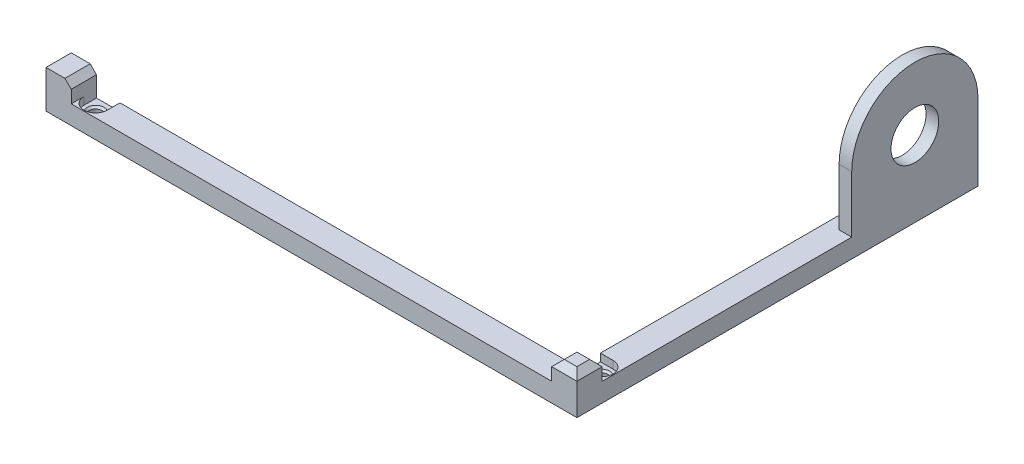
from build123d import *

# Parameters (mm, degrees)
BOSS_EXTRUDE1_DEPTH                    = 6.35
SKETCH3_W                              = 8.466666667
SKETCH3_H                              = 8.466666667
SKETCH3_W_2                            = 8.466666666
BOSS_EXTRUDE2_DEPTH                    = 6.349999915
SKETCH8_W                              = 8.466666666
SKETCH8_H                              = 8.466666666
BOSS_EXTRUDE4_DEPTH                    = 19.049999915
CUT_EXTRUDE1_DEPTH                     = 5.08
CUT_EXTRUDE2_DEPTH                     = 5.08
CUT_EXTRUDE3_DEPTH                     = 5.08
CHAMFER1_SIZE                          = 0.635
SKETCH7_R                              = 8
BOSS_EXTRUDE3_DEPTH                    = 4.233333333
CHAMFER2_SIZE                          = 2.116666709
CUT_EXTRUDE5_DEPTH                     = 2.54
F_18_0_1695_DIAMETER_HOLE1_D           = 4.3053
F_18_0_1695_DIAMETER_HOLE1_DEPTH       = 4.572
F_18_0_1695_DIAMETER_HOLE1_CSINK_D     = 5.5753
F_18_0_1695_DIAMETER_HOLE1_CSINK_ANGLE = 90
F_18_0_1695_DIAMETER_HOLE1_TIP         = 1.293442612


with BuildPart() as part:
    # Sketch2 → Boss-Extrude1 (new body)
    with BuildSketch(Plane(origin=(0, 0, 0), x_dir=(1, 0, 0), z_dir=(0, 1, 0))):
        Polygon((93.233827842, 63.000000026), (93.233827842, -71.466666693), (-84.767161176, -71.466666693), (-84.767161176, -63.000000026), (84.767161176, -63.000000026), (84.767161176, 63.000000026), align=None)
    extrude(amount=BOSS_EXTRUDE1_DEPTH)

    # Sketch3 → Boss-Extrude2 (add)
    with BuildSketch(Plane(origin=(0, 6.35, 0), x_dir=(1, 0, 0), z_dir=(0, 1, 0))):
        with Locations((-80.533827843, -67.23333336)):
            Rectangle(SKETCH3_W, SKETCH3_H)
        with Locations((89.000494509, -67.23333336)):
            Rectangle(SKETCH3_W_2, SKETCH3_H)
    extrude(amount=BOSS_EXTRUDE2_DEPTH)

    # Sketch8 → Boss-Extrude4 (add)
    with BuildSketch(Plane(origin=(0, 6.35, 0), x_dir=(1, 0, 0), z_dir=(0, 1, 0))):
        with Locations((89.000494509, 58.766666693)):
            Rectangle(SKETCH8_W, SKETCH8_H)
    extrude(amount=BOSS_EXTRUDE4_DEPTH)

    # Sketch4 → Cut-Extrude1 (cut)
    with BuildSketch(Plane.ZY.offset(84.767161176)):
        Polygon((64.05833336, 8.466666667), (67.23333336, 11.641666667), (70.40833336, 8.466666667), (67.23333336, 5.291666667), align=None)
    extrude(amount=-CUT_EXTRUDE1_DEPTH, mode=Mode.SUBTRACT)

    # Sketch5 → Cut-Extrude2 (cut)
    with BuildSketch(Plane(origin=(0, 0, -63.000000026), x_dir=(-1, 0, 0), z_dir=(0, 0, -1))):
        Polygon((-92.175494509, 8.466666667), (-89.000494509, 11.641666667), (-85.825494509, 8.466666667), (-89.000494509, 5.291666667), align=None)
        Polygon((-92.175494509, 21.166666582), (-89.000494509, 24.341666582), (-85.825494509, 21.166666582), (-89.000494509, 17.991666582), align=None)
    extrude(amount=-CUT_EXTRUDE2_DEPTH, mode=Mode.SUBTRACT)

    # Sketch6 → Cut-Extrude3 (cut)
    with BuildSketch(Plane.XZ):
        Polygon((85.825494509, 67.23333336), (89.000494509, 70.40833336), (92.175494509, 67.23333336), (89.000494509, 64.05833336), align=None)
    extrude(amount=-CUT_EXTRUDE3_DEPTH, mode=Mode.SUBTRACT)

    # Chamfer1
    chamfer1_edges = [part.edges().sort_by_distance(p)[0] for p in [
        (87.412994509, 5.08, 65.64583336),
        (87.412994509, 5.08, 68.82083336),
        (90.587994509, 5.08, 68.82083336),
        (90.587994509, 5.08, 65.64583336),
        (87.412994509, 0, 65.64583336),
        (90.587994509, 0, 65.64583336),
        (90.587994509, 0, 68.82083336),
        (87.412994509, 0, 68.82083336),
        (-79.687161176, 6.879166667, 65.64583336),
        (-79.687161176, 10.054166667, 65.64583336),
        (-79.687161176, 10.054166667, 68.82083336),
        (-79.687161176, 6.879166667, 68.82083336),
        (-84.767161176, 6.879166667, 65.64583336),
        (-84.767161176, 6.879166667, 68.82083336),
        (-84.767161176, 10.054166667, 68.82083336),
        (-84.767161176, 10.054166667, 65.64583336),
        (90.587994509, 6.879166667, -57.920000026),
        (90.587994509, 10.054166667, -57.920000026),
        (87.412994509, 10.054166667, -57.920000026),
        (87.412994509, 6.879166667, -57.920000026),
        (90.587994509, 6.879166667, -63.000000026),
        (87.412994509, 6.879166667, -63.000000026),
        (87.412994509, 10.054166667, -63.000000026),
        (90.587994509, 10.054166667, -63.000000026),
        (90.587994509, 19.579166582, -57.920000026),
        (90.587994509, 22.754166582, -57.920000026),
        (87.412994509, 22.754166582, -57.920000026),
        (87.412994509, 19.579166582, -57.920000026),
        (90.587994509, 19.579166582, -63.000000026),
        (87.412994509, 19.579166582, -63.000000026),
        (87.412994509, 22.754166582, -63.000000026),
        (90.587994509, 22.754166582, -63.000000026),
    ]]
    chamfer(chamfer1_edges, length=CHAMFER1_SIZE)

    # Sketch7 → Boss-Extrude3 (add)
    with BuildSketch(Plane(origin=(93.233827842, 0, 0), x_dir=(0, 0, -1), z_dir=(1, 0, 0))):
        with BuildLine():
            Line((20.666666693, 25.399999915), (20.666666693, 6.35))
            Line((20.666666693, 6.35), (54.53333336, 6.35))
            Line((54.53333336, 6.35), (54.53333336, 25.399999915))
            Line((54.53333336, 25.399999915), (63.000000026, 25.399999915))
            ThreePointArc((63.000000026, 25.399999915), (41.83333336, 46.566666582), (20.666666693, 25.399999915))
        make_face()
        with Locations((41.83333336, 25.399999915)):
            Circle(SKETCH7_R, mode=Mode.SUBTRACT)
    extrude(amount=-BOSS_EXTRUDE3_DEPTH)

    # Chamfer2
    chamfer2_edges = [part.edges().sort_by_distance(p)[0] for p in [
        (-76.300494509, 12.699999915, 67.23333336),
        (86.883827842, 25.399999915, -54.53333336),
        (89.000494509, 12.699999915, 63.000000026),
        (93.233827842, 12.699999915, 67.23333336),
        (89.000494509, 12.699999915, 71.466666693),
        (84.767161176, 12.699999915, 67.23333336),
    ]]
    chamfer(chamfer2_edges, length=CHAMFER2_SIZE)

    # Sketch9 → Cut-Extrude5 (cut)
    with BuildSketch(Plane(origin=(0, 6.35, 0), x_dir=(1, 0, 0), z_dir=(0, 1, 0))):
        with BuildLine():
            Line((-76.300494509, -67.233333526), (-76.300494509, -63.000000026))
            Line((-76.300494509, -63.000000026), (-68.426494509, -63.000000026))
            Line((-68.426494509, -63.000000026), (-68.426494509, -67.233333526))
            ThreePointArc((-68.426494509, -67.233333526), (-72.363494509, -71.170333526), (-76.300494509, -67.233333526))
        make_face()
        with BuildLine():
            Line((89.000494676, -55.126000026), (84.767161176, -55.126000026))
            Line((84.767161176, -55.126000026), (84.767161176, -63.000000026))
            Line((84.767161176, -63.000000026), (89.000494676, -63.000000026))
            ThreePointArc((89.000494676, -63.000000026), (92.937494676, -59.063000026), (89.000494676, -55.126000026))
        make_face()
    extrude(amount=-CUT_EXTRUDE5_DEPTH, mode=Mode.SUBTRACT)

    # #18 (0.1695) Diameter Hole1
    with Locations(Plane(origin=(0, 3.81, 0), x_dir=(1, 0, 0), z_dir=(0, 1, 0))):
        with Locations((89.000494676, -59.063000026), (-72.363494509, -67.233333526)):
            CounterSinkHole(F_18_0_1695_DIAMETER_HOLE1_D / 2, F_18_0_1695_DIAMETER_HOLE1_CSINK_D / 2, depth=F_18_0_1695_DIAMETER_HOLE1_DEPTH, counter_sink_angle=F_18_0_1695_DIAMETER_HOLE1_CSINK_ANGLE)
            with Locations((0, 0, -(F_18_0_1695_DIAMETER_HOLE1_DEPTH + F_18_0_1695_DIAMETER_HOLE1_TIP / 2))):  # 118° drill point
                Cone(0, F_18_0_1695_DIAMETER_HOLE1_D / 2, F_18_0_1695_DIAMETER_HOLE1_TIP, mode=Mode.SUBTRACT)


solid = part.part
